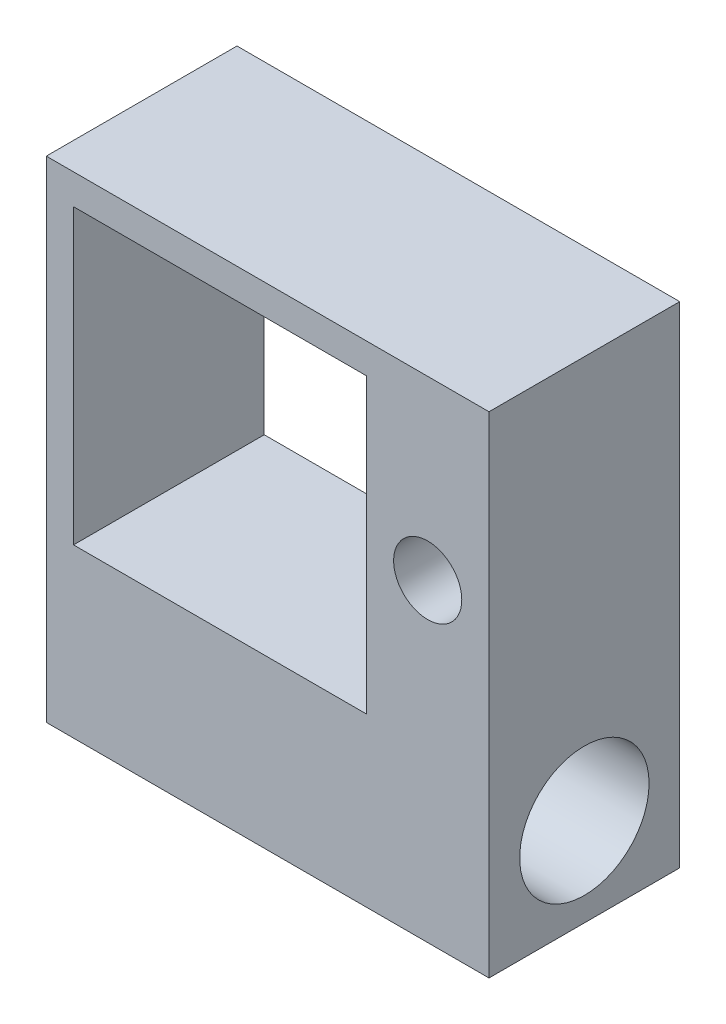
from build123d import *

# Parameters (mm, degrees)
SKETCH1_W           = 65
SKETCH1_H           = 72
SKETCH1_R           = 5
SKETCH1_W_2         = 43
SKETCH1_H_2         = 43
BOSS_EXTRUDE1_DEPTH = 28
SKETCH2_R           = 9.5
CUT_EXTRUDE1_DEPTH  = 80.404030124


with BuildPart() as part:
    # Sketch1 → Boss-Extrude1 (new body)
    with BuildSketch(Plane.XY):
        Rectangle(SKETCH1_W, SKETCH1_H)
        with Locations((23.5, 10.069230769)):
            Circle(SKETCH1_R, mode=Mode.SUBTRACT)
        with Locations((-7, 10.069230769)):
            Rectangle(SKETCH1_W_2, SKETCH1_H_2, mode=Mode.SUBTRACT)
    extrude(amount=BOSS_EXTRUDE1_DEPTH)

    # Sketch2 → Cut-Extrude1 (cut, through all)
    with BuildSketch(Plane(origin=(32.5, 0, 0), x_dir=(0, 0, -1), z_dir=(1, 0, 0))):
        with Locations((-14, -23)):
            Circle(SKETCH2_R)
    extrude(amount=-CUT_EXTRUDE1_DEPTH, mode=Mode.SUBTRACT)


solid = part.part
